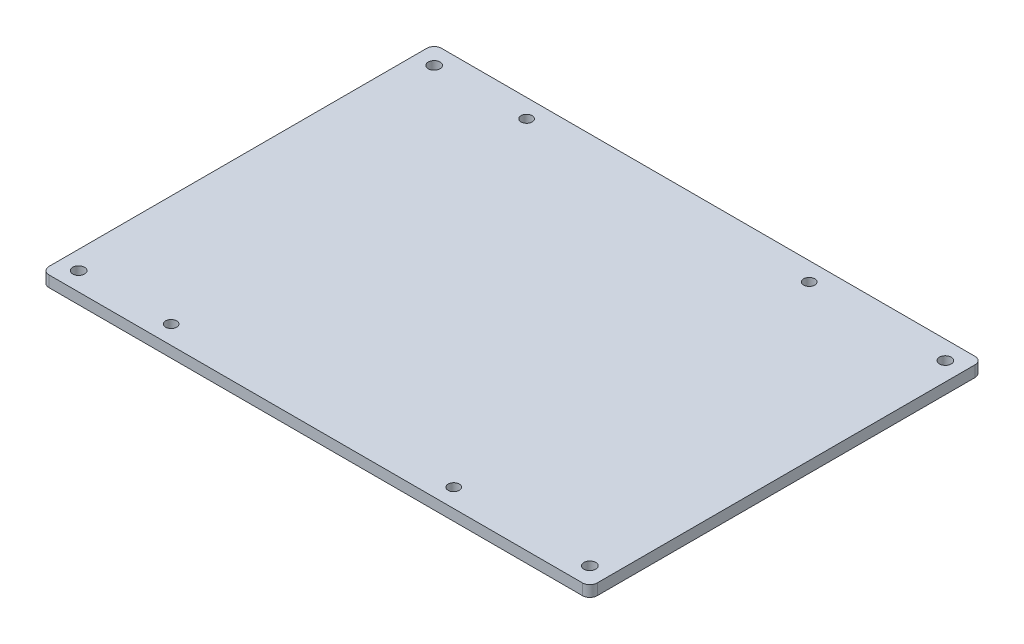
from build123d import *

# Parameters (mm, degrees)
SKETCH1_W           = 148.2
SKETCH1_H           = 106.1
SKETCH1_R           = 1.6
BOSS_EXTRUDE1_DEPTH = 3
FILLET1_R           = 2
CUT_EXTRUDE1_REACH  = 93.182
SKETCH3_R           = 1.5


with BuildPart() as part:
    # Sketch1 → Boss-Extrude1 (new body)
    with BuildSketch(Plane(origin=(0, 0, 0), x_dir=(1, 0, 0), z_dir=(0, 1, 0))):
        Rectangle(SKETCH1_W, SKETCH1_H)
        with Locations(Location((-69.1, 48.05, 0), (0, 0, 270))):
            Circle(SKETCH1_R, mode=Mode.SUBTRACT)
        with Locations(Location((-69.1, -48.05, 0), (0, 0, 90))):
            Circle(SKETCH1_R, mode=Mode.SUBTRACT)
        with Locations(Location((69.1, -48.05, 0), (0, 0, 270))):
            Circle(SKETCH1_R, mode=Mode.SUBTRACT)
        with Locations(Location((69.1, 48.05, 0), (0, 0, 90))):
            Circle(SKETCH1_R, mode=Mode.SUBTRACT)
    extrude(amount=BOSS_EXTRUDE1_DEPTH)

    # Fillet1
    fillet1_edges = [part.edges().sort_by_distance(p)[0] for p in [
        (-74.1, 1.5, -53.05),
        (74.1, 1.5, -53.05),
        (74.1, 1.5, 53.05),
        (-74.1, 1.5, 53.05),
    ]]
    fillet(fillet1_edges, radius=FILLET1_R)

    # Sketch3 → Cut-Extrude1 (cut, up to next)
    with BuildSketch(Plane.XZ, mode=Mode.PRIVATE) as cut_extrude1_sk1:
        with Locations(Location((32.3, 48.05, 0), (0, 0, 270))):
            Circle(SKETCH3_R)
    cut_extrude1_tool1 = extrude(cut_extrude1_sk1.sketch, amount=-CUT_EXTRUDE1_REACH, mode=Mode.PRIVATE) & part.part
    # Sketch3 → Cut-Extrude1 (cut, up to next)
    with BuildSketch(Plane.XZ, mode=Mode.PRIVATE) as cut_extrude1_sk2:
        with Locations(Location((-44.1, 48.05, 0), (0, 0, 270))):
            Circle(SKETCH3_R)
    cut_extrude1_tool2 = extrude(cut_extrude1_sk2.sketch, amount=-CUT_EXTRUDE1_REACH, mode=Mode.PRIVATE) & part.part
    # Sketch3 → Cut-Extrude1 (cut, up to next)
    with BuildSketch(Plane.XZ, mode=Mode.PRIVATE) as cut_extrude1_sk3:
        with Locations(Location((-44.1, -48.05, 0), (0, 0, 270))):
            Circle(SKETCH3_R)
    cut_extrude1_tool3 = extrude(cut_extrude1_sk3.sketch, amount=-CUT_EXTRUDE1_REACH, mode=Mode.PRIVATE) & part.part
    # Sketch3 → Cut-Extrude1 (cut, up to next)
    with BuildSketch(Plane.XZ, mode=Mode.PRIVATE) as cut_extrude1_sk4:
        with Locations(Location((32.3, -48.05, 0), (0, 0, 270))):
            Circle(SKETCH3_R)
    cut_extrude1_tool4 = extrude(cut_extrude1_sk4.sketch, amount=-CUT_EXTRUDE1_REACH, mode=Mode.PRIVATE) & part.part
    add(cut_extrude1_tool1.solids().sort_by_distance((32.3, 0, 48.05))[0], mode=Mode.SUBTRACT)
    add(cut_extrude1_tool2.solids().sort_by_distance((-44.1, 0, 48.05))[0], mode=Mode.SUBTRACT)
    add(cut_extrude1_tool3.solids().sort_by_distance((-44.1, 0, -48.05))[0], mode=Mode.SUBTRACT)
    add(cut_extrude1_tool4.solids().sort_by_distance((32.3, 0, -48.05))[0], mode=Mode.SUBTRACT)


solid = part.part
